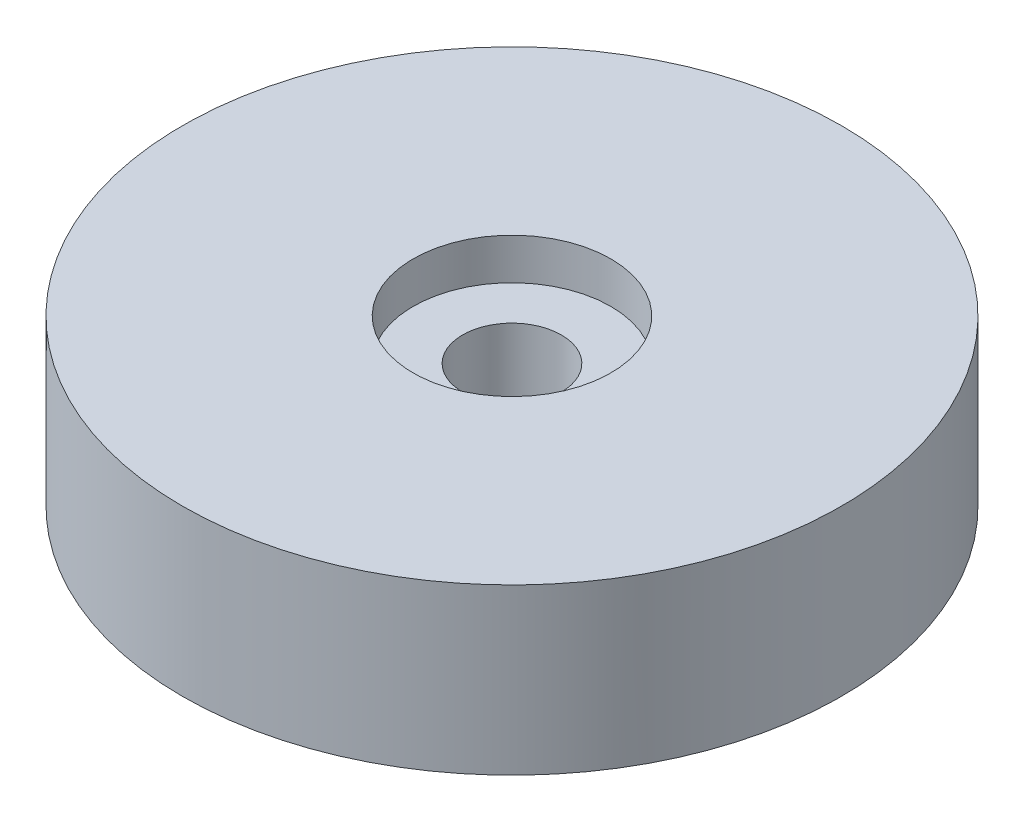
from build123d import *

# Parameters (mm, degrees)
BOSS_EXTRUDE1_DEPTH      = 3
BOSS_EXTRUDE1_DEPTH_BACK = 10
SKETCH1_R                = 10
SKETCH4_R                = 1.5
HOLE_DEPTH               = 20.973741561
HOLECIR_COUNT            = 5
SKETCH6_R                = 3
BEARINGHOLE_DEPTH        = 1.25
SKETCH7_R                = 1.5
SHAFTHOLE_DEPTH          = 17.248076982
SKETCH13_R               = 10
BOTTEN_HALF_DEPTH        = 10


with BuildPart() as part:
    # Sketch1 → Boss-Extrude1 (new, two sides: drawn at the far end of the back side and taken through both)
    with BuildSketch(Plane(origin=(0, 0, 0), x_dir=(1, 0, 0), z_dir=(0, 1, 0)).offset(-BOSS_EXTRUDE1_DEPTH_BACK)):
        Circle(SKETCH1_R)
    extrude(amount=BOSS_EXTRUDE1_DEPTH + BOSS_EXTRUDE1_DEPTH_BACK)

    # Sketch4 → hole (cut, through all)
    with BuildSketch(Plane(origin=(-3.352872105, -1.093066116, 1.887711608), x_dir=(-0.4486862613641547, -0.14627571033740308, -0.8816371449912632), z_dir=(0.8382180262940947, 0.2732665289126682, -0.47192790187872385))):
        Circle(SKETCH4_R)
    hole = extrude(amount=-HOLE_DEPTH, mode=Mode.SUBTRACT)

    # holecir: hole ×5 about axis
    holecir_axis = Axis((0, 5.5, 0), (0, -1, 0))
    for i in range(1, HOLECIR_COUNT):
        add(hole.rotate(holecir_axis, i * 360 / HOLECIR_COUNT), mode=Mode.SUBTRACT)

    # Sketch6 → bearinghole (cut, symmetric)
    with BuildSketch(Plane(origin=(0, -5, 0), x_dir=(-1, 0, 0), z_dir=(0, -1, 0))):
        Circle(SKETCH6_R)
    extrude(amount=BEARINGHOLE_DEPTH, both=True, mode=Mode.SUBTRACT)

    # Sketch7 → shafthole (cut, through all)
    with BuildSketch(Plane(origin=(0, -5, 0), x_dir=(-1, 0, 0), z_dir=(0, -1, 0))):
        Circle(SKETCH7_R)
    extrude(amount=SHAFTHOLE_DEPTH, mode=Mode.SUBTRACT)

    # Sketch13 → botten half (cut)
    with BuildSketch(Plane(origin=(0, -5, 0), x_dir=(-1, 0, 0), z_dir=(0, -1, 0))):
        Circle(SKETCH13_R)
    extrude(amount=-BOTTEN_HALF_DEPTH, mode=Mode.SUBTRACT)


solid = part.part
